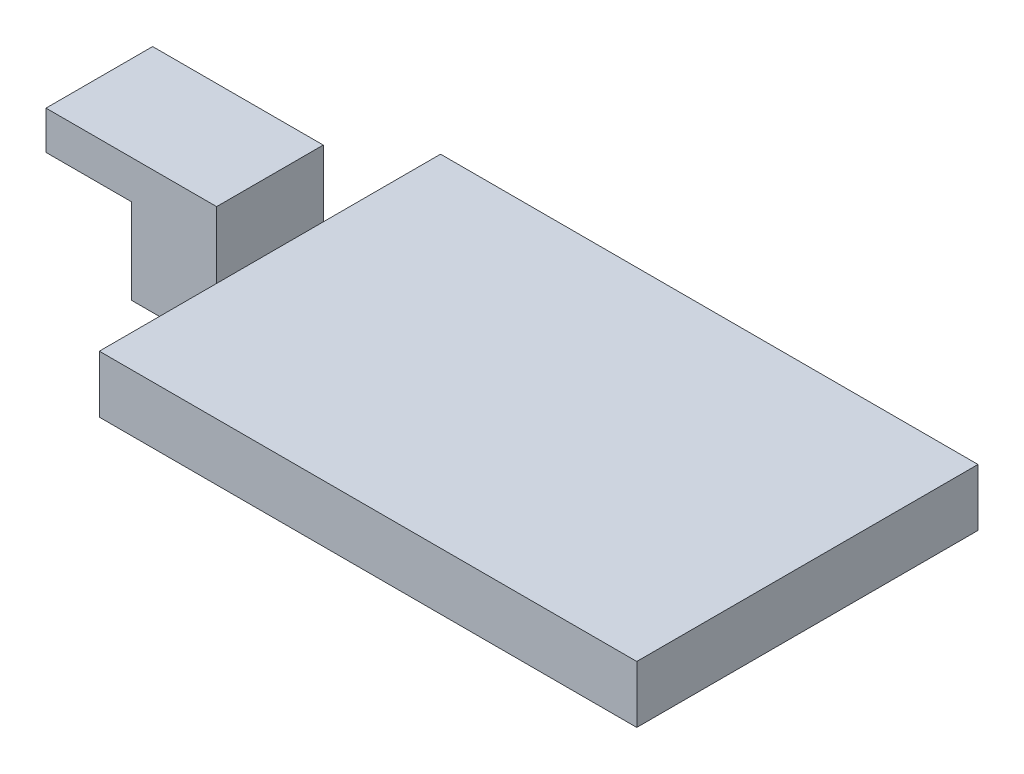
from build123d import *

# Parameters (mm, degrees)
SKETCH1_W           = 10.16
SKETCH1_H           = 6.35
BOSS_EXTRUDE1_DEPTH = 2.286
SKETCH2_W           = 5.842
SKETCH2_H           = 1.778
CUT_EXTRUDE1_DEPTH  = 8.89
SKETCH3_W           = 5.08
SKETCH3_H           = 6.35
BOSS_EXTRUDE2_DEPTH = 5.08
SKETCH4_W           = 20.32
SKETCH4_H           = 3.4036
BOSS_EXTRUDE3_DEPTH = 32.004


with BuildPart() as part:
    # Sketch1 → Boss-Extrude1 (new body)
    with BuildSketch(Plane(origin=(0, 0, 0), x_dir=(1, 0, 0), z_dir=(0, 1, 0))):
        with Locations((5.08, 3.175)):
            Rectangle(SKETCH1_W, SKETCH1_H)
    extrude(amount=BOSS_EXTRUDE1_DEPTH)

    # Sketch2 → Cut-Extrude1 (cut)
    with BuildSketch(Plane.ZY):
        with Locations((-3.1242, 1.0922)):
            Rectangle(SKETCH2_W, SKETCH2_H)
    extrude(amount=-CUT_EXTRUDE1_DEPTH, mode=Mode.SUBTRACT)

    # Sketch3 → Boss-Extrude2 (add)
    with BuildSketch(Plane.XZ):
        with Locations((7.62, -3.175)):
            Rectangle(SKETCH3_W, SKETCH3_H)
    extrude(amount=BOSS_EXTRUDE2_DEPTH)

    # Sketch4 → Boss-Extrude3 (add)
    with BuildSketch(Plane(origin=(10.16, 0, 0), x_dir=(0, 0, -1), z_dir=(1, 0, 0))):
        with Locations((3.175, -3.3782)):
            Rectangle(SKETCH4_W, SKETCH4_H)
    extrude(amount=BOSS_EXTRUDE3_DEPTH)


solid = part.part
